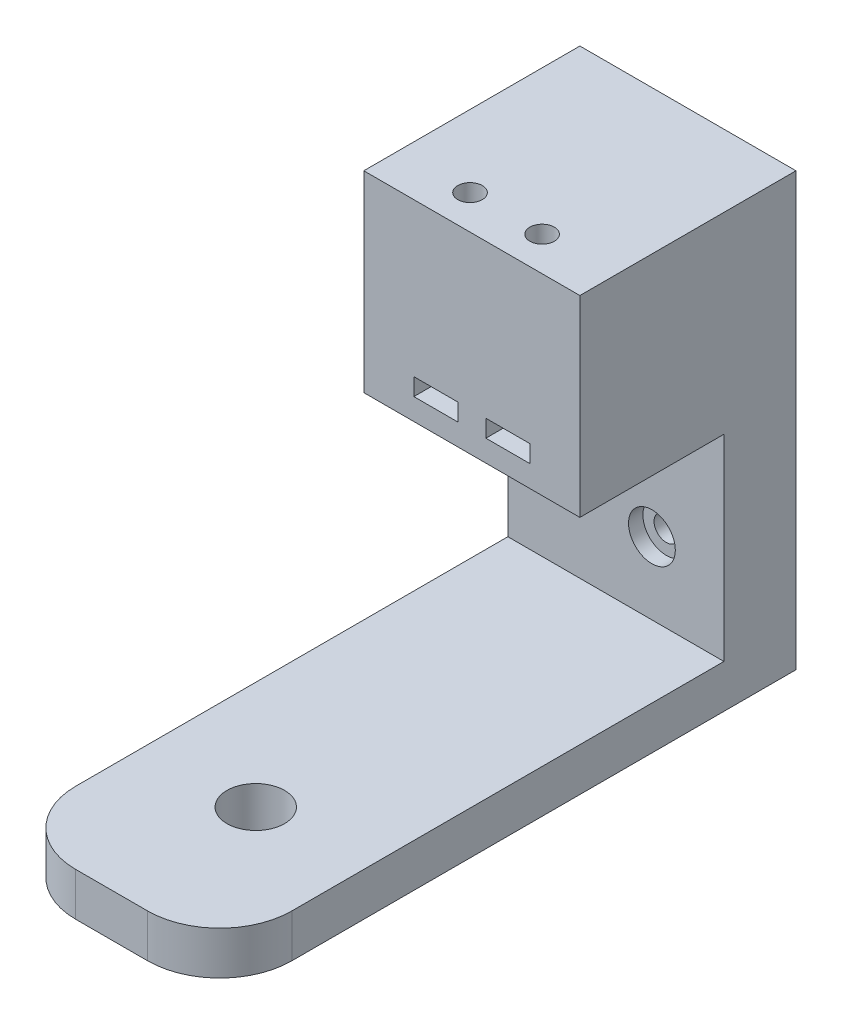
from build123d import *

# Parameters (mm, degrees)
ESQUISSE1_W                                          = 30
ESQUISSE1_H                                          = 60
BOSS_EXTRU_1_DEPTH                                   = 10
ESQUISSE2_W                                          = 30
ESQUISSE2_H                                          = 6
BOSS_EXTRU_2_DEPTH                                   = 70
ESQUISSE3_R                                          = 4
ENL_V_MAT_EXTRU_1_DEPTH                              = 6
ESQUISSE4_W                                          = 30
ESQUISSE4_H                                          = 26.68
BOSS_EXTRU_3_DEPTH                                   = 20
D_GAGEMENT_M31_D                                     = 3.4
D_GAGEMENT_M31_DEPTH                                 = 26.68
D_GAGEMENT_M31_TIP                                   = 1.021463052
CHAMBRAGE_POUR_T_TE_CYLINDRIQUE_FENDUE_M_D           = 3.4
CHAMBRAGE_POUR_T_TE_CYLINDRIQUE_FENDUE_M_DEPTH       = 10
CHAMBRAGE_POUR_T_TE_CYLINDRIQUE_FENDUE_M_CBORE_D     = 6.5
CHAMBRAGE_POUR_T_TE_CYLINDRIQUE_FENDUE_M_CBORE_DEPTH = 2
CHAMBRAGE_POUR_T_TE_CYLINDRIQUE_FENDUE_M_TIP         = 1.021463052
CONG_1_R                                             = 10
ESQUISSE13_W                                         = 6.1
ESQUISSE13_H                                         = 2.4
ENL_V_MAT_EXTRU_2_DEPTH                              = 8.45


with BuildPart() as part:
    # Esquisse1 → Boss.-Extru.1 (new body)
    with BuildSketch(Plane.XY):
        with Locations((15, 30)):
            Rectangle(ESQUISSE1_W, ESQUISSE1_H)
    extrude(amount=BOSS_EXTRU_1_DEPTH)

    # Esquisse2 → Boss.-Extru.2 (add)
    with BuildSketch(Plane.XY.offset(10)):
        with Locations((15, 3)):
            Rectangle(ESQUISSE2_W, ESQUISSE2_H)
    extrude(amount=BOSS_EXTRU_2_DEPTH)

    # Esquisse3 → Enlèv. mat.-Extru.1 (cut)
    with BuildSketch(Plane.XZ):
        with Locations(Location((15, 60, 0), (0, 0, 270))):
            Circle(ESQUISSE3_R)
    extrude(amount=-ENL_V_MAT_EXTRU_1_DEPTH, mode=Mode.SUBTRACT)

    # Esquisse4 → Boss.-Extru.3 (add)
    with BuildSketch(Plane.XY.offset(10)):
        with Locations((15, 46.66)):
            Rectangle(ESQUISSE4_W, ESQUISSE4_H)
    extrude(amount=BOSS_EXTRU_3_DEPTH)

    # Dégagement M31
    with Locations(Plane(origin=(0, 33.32, 0), x_dir=(-1, 0, 0), z_dir=(0, -1, 0))):
        with Locations((-10, -25.25), (-20, -25.25)):
            Hole(D_GAGEMENT_M31_D / 2, depth=D_GAGEMENT_M31_DEPTH)
            with Locations((0, 0, -(D_GAGEMENT_M31_DEPTH + D_GAGEMENT_M31_TIP / 2))):  # 118° drill point
                Cone(0, D_GAGEMENT_M31_D / 2, D_GAGEMENT_M31_TIP, mode=Mode.SUBTRACT)

    # Chambrage pour tête cylindrique fendue M31
    with Locations(Plane.XY.offset(10)):
        with Locations((10, 23.32), (20, 16)):
            CounterBoreHole(CHAMBRAGE_POUR_T_TE_CYLINDRIQUE_FENDUE_M_D / 2, CHAMBRAGE_POUR_T_TE_CYLINDRIQUE_FENDUE_M_CBORE_D / 2, CHAMBRAGE_POUR_T_TE_CYLINDRIQUE_FENDUE_M_CBORE_DEPTH, depth=CHAMBRAGE_POUR_T_TE_CYLINDRIQUE_FENDUE_M_DEPTH)
            with Locations((0, 0, -(CHAMBRAGE_POUR_T_TE_CYLINDRIQUE_FENDUE_M_DEPTH + CHAMBRAGE_POUR_T_TE_CYLINDRIQUE_FENDUE_M_TIP / 2))):  # 118° drill point
                Cone(0, CHAMBRAGE_POUR_T_TE_CYLINDRIQUE_FENDUE_M_D / 2, CHAMBRAGE_POUR_T_TE_CYLINDRIQUE_FENDUE_M_TIP, mode=Mode.SUBTRACT)

    # Congé1
    cong_1_edges = [part.edges().sort_by_distance(p)[0] for p in [
        (30, 3, 80),
        (0, 3, 80),
    ]]
    fillet(cong_1_edges, radius=CONG_1_R)

    # Esquisse13 → Enlèv. mat.-Extru.2 (cut)
    with BuildSketch(Plane.XY.offset(30)):
        with Locations((10, 37.52)):
            Rectangle(ESQUISSE13_W, ESQUISSE13_H)
        with Locations((20, 37.52)):
            Rectangle(ESQUISSE13_W, ESQUISSE13_H)
    extrude(amount=-ENL_V_MAT_EXTRU_2_DEPTH, mode=Mode.SUBTRACT)


solid = part.part
